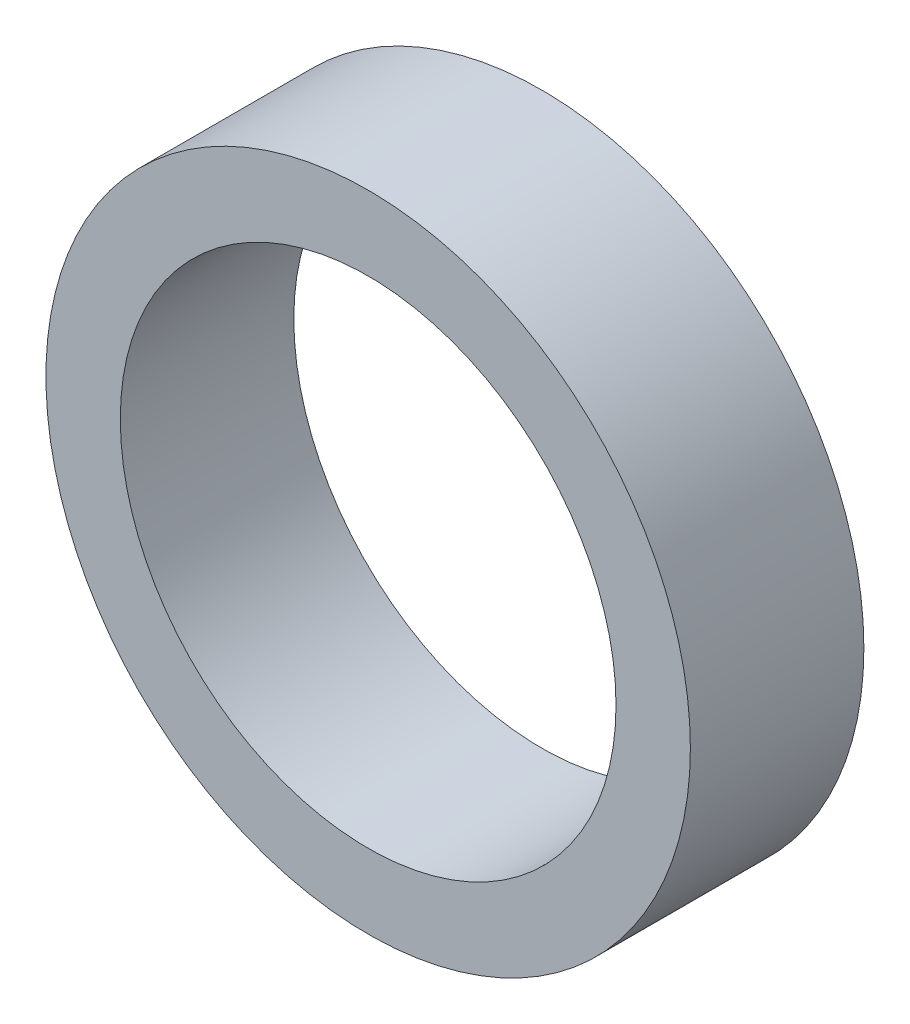
from build123d import *

# Parameters (mm, degrees)
SKETCH1_R           = 6.5
BOSS_EXTRUDE1_DEPTH = 3.5
SKETCH5_R           = 5
CUT_EXTRUDE3_DEPTH  = 3.5


with BuildPart() as part:
    # Sketch1 → Boss-Extrude1 (new body)
    with BuildSketch(Plane.XY):
        Circle(SKETCH1_R)
    extrude(amount=BOSS_EXTRUDE1_DEPTH)

    # Sketch5 → Cut-Extrude3 (cut)
    with BuildSketch(Plane.XY.offset(3.5)):
        Circle(SKETCH5_R)
    extrude(amount=-CUT_EXTRUDE3_DEPTH, mode=Mode.SUBTRACT)


solid = part.part
